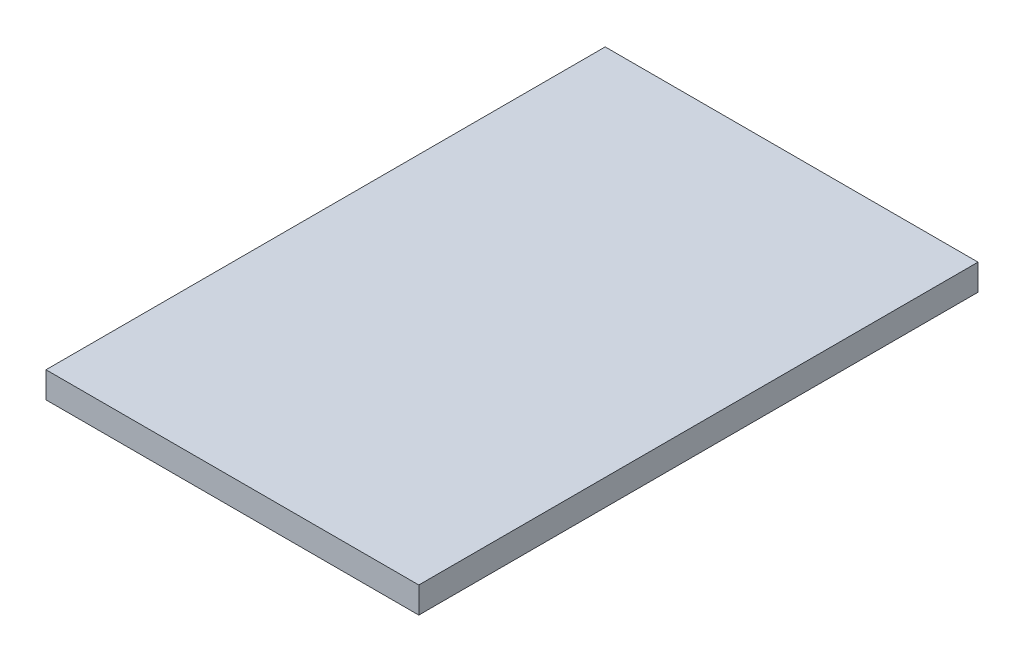
from build123d import *

# Parameters (mm, degrees)
CROQUIS1_W              = 10
CROQUIS1_H              = 15
SALIENTE_EXTRUIR1_DEPTH = 0.7


with BuildPart() as part:
    # Croquis1 → Saliente-Extruir1 (new body)
    with BuildSketch(Plane.XZ.offset(0.7)):
        with Locations((5, 0)):
            Rectangle(CROQUIS1_W, CROQUIS1_H)
    extrude(amount=-SALIENTE_EXTRUIR1_DEPTH)


solid = part.part
